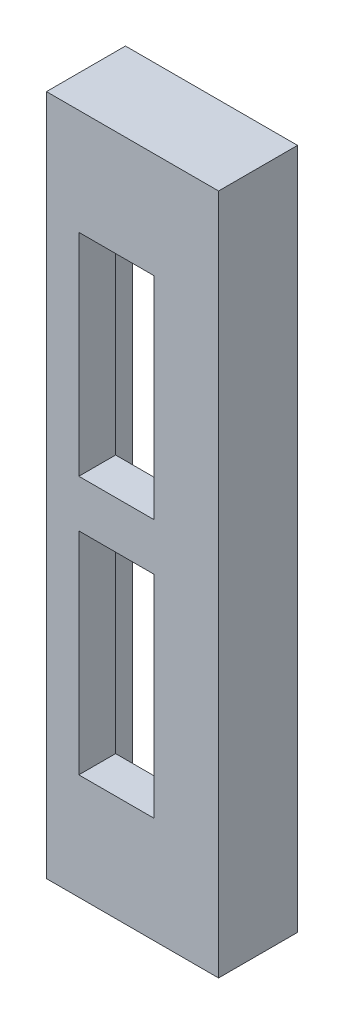
from build123d import *

# Parameters (mm, degrees)
SKETCH1_W               = 11
SKETCH1_H               = 31
BOSS_EXTRUDE1_DEPTH     = 3.81
SKETCH1_W_2             = 31
SKETCH1_H_2             = 11
BOSS_EXTRUDE1_2_DEPTH   = 3.81
BOSS_EXTRUDE1_3_DEPTH   = 3.81
BOSS_EXTRUDE1_4_DEPTH   = 3.81
BOSS_EXTRUDE1_5_DEPTH   = 3.81
SKETCH1_W_3             = 80
SKETCH1_H_3             = 100
SKETCH1_W_4             = 78.5
SKETCH1_H_4             = 98.5
BOSS_EXTRUDE1_6_DEPTH   = 3.81
SKETCH3_W               = 80
SKETCH3_H               = 100
SKETCH3_W_2             = 31
SKETCH3_H_2             = 11
SKETCH3_W_3             = 11
SKETCH3_H_3             = 31
BOSS_EXTRUDE2_DEPTH     = 1.5875
FILLET1_R               = 0.05
SKETCH4_W               = 80
SKETCH4_H               = 100
BOSS_EXTRUDE3_DEPTH     = 6.191
CUT_EXTRUDE1_DEPTH      = 65.807561295
CUT_EXTRUDE1_DEPTH_BACK = 65.807561295
SKETCH5_W               = 56.628696971
SKETCH5_H               = 106.323278981
CUT_EXTRUDE2_DEPTH      = 3.81
SKETCH7_W               = 1.5875
SKETCH7_H               = 11
BOSS_EXTRUDE4_DEPTH     = 0.75
SKETCH8_W               = 11.5885
SKETCH8_H               = 100
BOSS_EXTRUDE5_DEPTH     = 1


with BuildPart() as part:
    # Sketch1 → Boss-Extrude1 (new body)
    with BuildSketch(Plane.XY):
        Polygon((-26.313903431, 0.439060111), (-31.5, 2.5), (-31.5, 35.5), (-25.083245041, 38.05), (-18.5, 35.5), (-18.5, 2.5), (-23.846750882, 0.428952262), (-23.616775358, 0.03062297), (-23.846750882, -0.367706323), (-18.5, -2.438754061), (-18.5, -35.438754061), (-25.083245041, -37.988754061), (-31.5, -35.438754061), (-31.5, -2.438754061), (-26.313903431, -0.377814172), (-26.549714725, 0.03062297), align=None)
        with Locations((-25, -18.938754061)):
            Rectangle(SKETCH1_W, SKETCH1_H, mode=Mode.SUBTRACT)
        with Locations((-25, 19)):
            Rectangle(SKETCH1_W, SKETCH1_H, mode=Mode.SUBTRACT)
    extrude(amount=BOSS_EXTRUDE1_DEPTH)



with BuildPart() as body_2:
    # Sketch1 → Boss-Extrude1 2 (new body)
    with BuildSketch(Plane.XY):
        Polygon((-19.05, 0.03062297), (-16.5, 6.5), (16.5, 6.5), (19.05, 0.03062297), (16.5, -6.438754061), (-16.5, -6.438754061), align=None)
        Rectangle(SKETCH1_W_2, SKETCH1_H_2, mode=Mode.SUBTRACT)
    extrude(amount=BOSS_EXTRUDE1_2_DEPTH)


with BuildPart() as body_3:
    # Sketch1 → Boss-Extrude1 3 (new body)
    with BuildSketch(Plane.XY):
        Polygon((26.313903431, 0.439060111), (26.549714725, 0.03062297), (26.313903431, -0.377814172), (31.5, -2.438754061), (31.5, -35.438754061), (25.083245041, -37.988754061), (18.5, -35.438754061), (18.5, -2.438754061), (23.846750882, -0.367706323), (23.616775358, 0.03062297), (23.846750882, 0.428952262), (18.5, 2.5), (18.5, 35.5), (25.083245041, 38.05), (31.5, 35.5), (31.5, 2.5), align=None)
        with Locations((25, 19)):
            Rectangle(SKETCH1_W, SKETCH1_H, mode=Mode.SUBTRACT)
        with Locations((25, -18.938754061)):
            Rectangle(SKETCH1_W, SKETCH1_H, mode=Mode.SUBTRACT)
    extrude(amount=BOSS_EXTRUDE1_3_DEPTH)


with BuildPart() as body_4:
    # Sketch1 → Boss-Extrude1 4 (new body)
    with BuildSketch(Plane.XY):
        Polygon((-16.5, 31.52602227), (-19.05, 38.013011135), (-16.5, 44.5), (16.5, 44.5), (19.05, 38.013011135), (16.5, 31.52602227), align=None)
        with Locations((0, 38)):
            Rectangle(SKETCH1_W_2, SKETCH1_H_2, mode=Mode.SUBTRACT)
    extrude(amount=BOSS_EXTRUDE1_4_DEPTH)


with BuildPart() as body_5:
    # Sketch1 → Boss-Extrude1 5 (new body)
    with BuildSketch(Plane.XY):
        Polygon((16.5, -31.464776331), (19.05, -37.951765196), (16.5, -44.438754061), (-16.5, -44.438754061), (-19.05, -37.951765196), (-16.5, -31.464776331), align=None)
        with Locations((0, -37.938754061)):
            Rectangle(SKETCH1_W_2, SKETCH1_H_2, mode=Mode.SUBTRACT)
    extrude(amount=BOSS_EXTRUDE1_5_DEPTH)


with BuildPart() as body_6:
    # Sketch1 → Boss-Extrude1 6 (new body)
    with BuildSketch(Plane.XY):
        Rectangle(SKETCH1_W_3, SKETCH1_H_3)
        Rectangle(SKETCH1_W_4, SKETCH1_H_4, mode=Mode.SUBTRACT)
    extrude(amount=BOSS_EXTRUDE1_6_DEPTH)


with BuildPart() as part_1:
    add(part.part)

    add(body_2.part)  # Boss-Extrude2 merges body 2

    add(body_3.part)  # Boss-Extrude2 merges body 3

    add(body_4.part)  # Boss-Extrude2 merges body 4

    add(body_5.part)  # Boss-Extrude2 merges body 5

    add(body_6.part)  # Boss-Extrude2 merges body 6
    # Sketch3 → Boss-Extrude2 (add)
    with BuildSketch(Plane.XY.offset(3.81)):
        Rectangle(SKETCH3_W, SKETCH3_H)
        with Locations((0, -37.938754061)):
            Rectangle(SKETCH3_W_2, SKETCH3_H_2, mode=Mode.SUBTRACT)
        Rectangle(SKETCH3_W_2, SKETCH3_H_2, mode=Mode.SUBTRACT)
        with Locations((-25, -18.938754061)):
            Rectangle(SKETCH3_W_3, SKETCH3_H_3, mode=Mode.SUBTRACT)
        with Locations((-25, 19)):
            Rectangle(SKETCH3_W_3, SKETCH3_H_3, mode=Mode.SUBTRACT)
        with Locations((0, 38)):
            Rectangle(SKETCH3_W_2, SKETCH3_H_2, mode=Mode.SUBTRACT)
        with Locations((25, 19)):
            Rectangle(SKETCH3_W_3, SKETCH3_H_3, mode=Mode.SUBTRACT)
        with Locations((25, -18.938754061)):
            Rectangle(SKETCH3_W_3, SKETCH3_H_3, mode=Mode.SUBTRACT)
    extrude(amount=BOSS_EXTRUDE2_DEPTH)

    # Fillet1
    fillet1_edges = [part_1.edges().sort_by_distance(p)[0] for p in [
        (39.25, 49.25, 1.905),
        (39.25, -49.25, 1.905),
        (-39.25, -49.25, 1.905),
        (-39.25, 49.25, 1.905),
    ]]
    fillet(fillet1_edges, radius=FILLET1_R)

    # Sketch4 → Boss-Extrude3 (add)
    with BuildSketch(Plane(origin=(0, 0, 0), x_dir=(-1, 0, 0), z_dir=(0, 0, -1))):
        Rectangle(SKETCH4_W, SKETCH4_H)
        with BuildLine():
            Line((-39.2, -49.25), (39.2, -49.25))
            ThreePointArc((39.2, -49.25), (39.235355339, -49.235355339), (39.25, -49.2))
            Line((39.25, -49.2), (39.25, 49.2))
            ThreePointArc((39.25, 49.2), (39.235355339, 49.235355339), (39.2, 49.25))
            Line((39.2, 49.25), (-39.2, 49.25))
            ThreePointArc((-39.2, 49.25), (-39.235355339, 49.235355339), (-39.25, 49.2))
            Line((-39.25, 49.2), (-39.25, -49.2))
            ThreePointArc((-39.25, -49.2), (-39.235355339, -49.235355339), (-39.2, -49.25))
        make_face(mode=Mode.SUBTRACT)
    extrude(amount=BOSS_EXTRUDE3_DEPTH)

    # Sketch5 → Cut-Extrude1 (cut, two sides: drawn at the far end of the back side and taken through both)
    with BuildSketch(Plane(origin=(0, 0, 3.81), x_dir=(-1, 0, 0), z_dir=(0, 0, -1)).offset(-CUT_EXTRUDE1_DEPTH_BACK)):
        with Locations((13.564348486, -0.302353259)):
            Rectangle(SKETCH5_W, SKETCH5_H)
    extrude(amount=CUT_EXTRUDE1_DEPTH + CUT_EXTRUDE1_DEPTH_BACK, mode=Mode.SUBTRACT)

    # Sketch6 → Cut-Extrude2 (cut)
    with BuildSketch(Plane(origin=(0, 0, 0), x_dir=(-1, 0, 0), z_dir=(0, 0, -1))):
        Polygon((-16.5, -44.438754061), (-14.75, -44.438754061), (-14.75, -43.438754061), (-15.5, -43.438754061), (-15.5, -32.438754061), (-14.75, -32.438754061), (-14.75, -31.464776331), (-16.5, -31.464776331), (-19.05, -37.951765196), align=None)
        Polygon((-16.5, -6.438754061), (-14.75, -6.438754061), (-14.75, -5.5), (-15.5, -5.5), (-15.5, 5.5), (-14.75, 5.5), (-14.75, 6.5), (-16.5, 6.5), (-19.05, 0.03062297), align=None)
        Polygon((-16.5, 31.52602227), (-14.75, 31.52602227), (-14.75, 32.5), (-15.5, 32.5), (-15.5, 43.5), (-14.75, 43.5), (-14.75, 44.5), (-16.5, 44.5), (-19.05, 38.013011135), align=None)
    extrude(amount=-CUT_EXTRUDE2_DEPTH, mode=Mode.SUBTRACT)

    # Sketch7 → Boss-Extrude4 (add)
    with BuildSketch(Plane.ZY.offset(-15.5)):
        with Locations((4.60375, 38)):
            Rectangle(SKETCH7_W, SKETCH7_H)
        with Locations((4.60375, 0)):
            Rectangle(SKETCH7_W, SKETCH7_H)
        with Locations((4.60375, -37.938754061)):
            Rectangle(SKETCH7_W, SKETCH7_H)
    extrude(amount=BOSS_EXTRUDE4_DEPTH)

    # Sketch8 → Boss-Extrude5 (add)
    with BuildSketch(Plane.ZY.offset(-14.75)):
        with Locations((-0.39675, 0)):
            Rectangle(SKETCH8_W, SKETCH8_H)
    extrude(amount=-BOSS_EXTRUDE5_DEPTH)


solid = part_1.part
